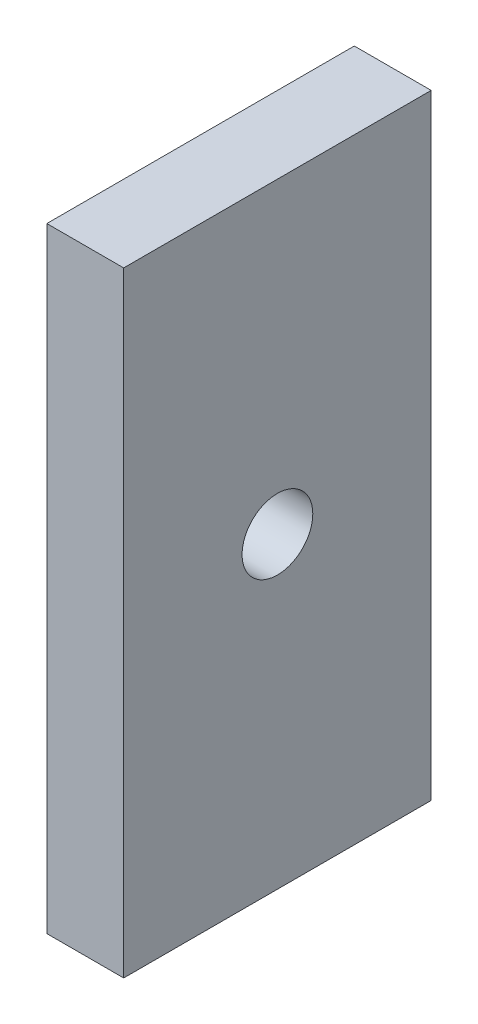
from build123d import *

# Parameters (mm, degrees)
SKETCH4_W           = 12.7
SKETCH4_H           = 25.4
BOSS_EXTRUDE2_DEPTH = 3.175
SKETCH5_R           = 1.4605
CUT_EXTRUDE1_DEPTH  = 29.575


with BuildPart() as part:
    # Sketch4 → Boss-Extrude2 (new body)
    with BuildSketch(Plane(origin=(0, 0, 0), x_dir=(0, 0, -1), z_dir=(1, 0, 0))):
        with Locations((6.35, 12.7)):
            Rectangle(SKETCH4_W, SKETCH4_H)
    extrude(amount=BOSS_EXTRUDE2_DEPTH)

    # Sketch5 → Cut-Extrude1 (cut, through all)
    with BuildSketch(Plane(origin=(3.175, 0, 0), x_dir=(0, 0, -1), z_dir=(1, 0, 0))):
        with Locations((6.35, 12.7)):
            Circle(SKETCH5_R)
    extrude(amount=-CUT_EXTRUDE1_DEPTH, mode=Mode.SUBTRACT)


solid = part.part
